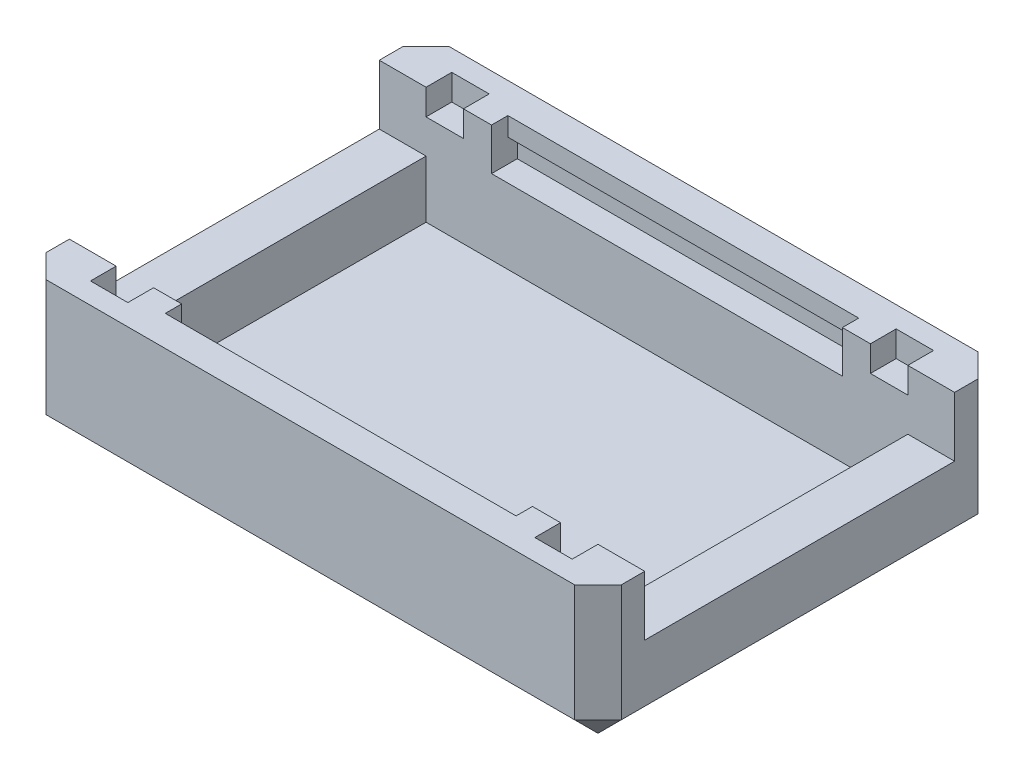
from build123d import *

# Parameters (mm, degrees)
SKETCH1_W           = 24.6
SKETCH1_H           = 17.25
SKETCH1_W_2         = 20.6
SKETCH1_H_2         = 13.25
BOSS_EXTRUDE1_DEPTH = 6
SKETCH2_W           = 20.6
SKETCH2_H           = 13.25
BOSS_EXTRUDE2_DEPTH = 1
SKETCH3_W           = 2
SKETCH3_H           = 13.25
CUT_EXTRUDE1_DEPTH  = 2.55
SKETCH4_W           = 1.6
SKETCH4_H           = 1.1
CUT_EXTRUDE2_DEPTH  = 1.1
SKETCH5_W           = 15
SKETCH5_H           = 1.4
CUT_EXTRUDE3_DEPTH  = 1.8
SKETCH6_W           = 15
SKETCH6_H           = 1
CUT_EXTRUDE4_DEPTH  = 0.4
CHAMFER1_SIZE       = 1
SKETCH8_W           = 0.37991453
SKETCH8_H           = 2.116666667
CUT_EXTRUDE5_DEPTH  = 0.2


with BuildPart() as part:
    # Sketch1 → Boss-Extrude1 (new body)
    with BuildSketch(Plane(origin=(0, 0, 0), x_dir=(1, 0, 0), z_dir=(0, 1, 0))):
        Rectangle(SKETCH1_W, SKETCH1_H)
        Rectangle(SKETCH1_W_2, SKETCH1_H_2, mode=Mode.SUBTRACT)
    extrude(amount=BOSS_EXTRUDE1_DEPTH)

    # Sketch2 → Boss-Extrude2 (add)
    with BuildSketch(Plane.XZ):
        Rectangle(SKETCH2_W, SKETCH2_H)
    extrude(amount=-BOSS_EXTRUDE2_DEPTH)

    # Sketch3 → Cut-Extrude1 (cut)
    with BuildSketch(Plane(origin=(0, 6, 0), x_dir=(1, 0, 0), z_dir=(0, 1, 0))):
        with Locations((-11.3, 0)):
            Rectangle(SKETCH3_W, SKETCH3_H)
        with Locations((11.3, 0)):
            Rectangle(SKETCH3_W, SKETCH3_H)
    extrude(amount=-CUT_EXTRUDE1_DEPTH, mode=Mode.SUBTRACT)

    # Sketch4 → Cut-Extrude2 (cut)
    with BuildSketch(Plane(origin=(0, 6, 0), x_dir=(1, 0, 0), z_dir=(0, 1, 0))):
        with Locations((-9.5, 7.175)):
            Rectangle(SKETCH4_W, SKETCH4_H)
        with Locations((9.5, 7.175)):
            Rectangle(SKETCH4_W, SKETCH4_H)
        with Locations((9.5, -7.175)):
            Rectangle(SKETCH4_W, SKETCH4_H)
        with Locations((-9.5, -7.175)):
            Rectangle(SKETCH4_W, SKETCH4_H)
    extrude(amount=-CUT_EXTRUDE2_DEPTH, mode=Mode.SUBTRACT)

    # Sketch5 → Cut-Extrude3 (cut)
    with BuildSketch(Plane(origin=(0, 6, 0), x_dir=(1, 0, 0), z_dir=(0, 1, 0))):
        with Locations((0, 6.625)):
            Rectangle(SKETCH5_W, SKETCH5_H)
        with Locations((0, -6.625)):
            Rectangle(SKETCH5_W, SKETCH5_H)
    extrude(amount=-CUT_EXTRUDE3_DEPTH, mode=Mode.SUBTRACT)

    # Sketch6 → Cut-Extrude4 (cut)
    with BuildSketch(Plane.XY.offset(-7.325)):
        with Locations((0, 4.7)):
            Rectangle(SKETCH6_W, SKETCH6_H)
    cut_extrude4 = extrude(amount=-CUT_EXTRUDE4_DEPTH, mode=Mode.SUBTRACT)

    # Mirror1: Cut-Extrude4 across plane
    add(cut_extrude4.mirror(Plane.XY), mode=Mode.SUBTRACT)

    # Chamfer1
    chamfer1_edges = [part.edges().sort_by_distance(p)[0] for p in [
        (-12.3, 0, 0),
        (0, 0, -8.625),
        (12.3, 0, 0),
        (0, 0, 8.625),
        (-12.3, 3, 8.625),
        (-12.3, 3, -8.625),
        (12.3, 3, -8.625),
        (12.3, 3, 8.625),
    ]]
    chamfer(chamfer1_edges, length=CHAMFER1_SIZE)

    # Sketch8 → Cut-Extrude5 (cut)
    # profile 1 of 11: a face of its own
    with BuildSketch(Plane.XZ):
        with BuildLine():
            Line((-2.221821581, 4.725609767), (-2.576931424, 4.400710762))
            add(Edge.make_bspline(
                [(-2.576931424, 4.400710762), (-2.592142807, 4.422167999), (-2.621346541, 4.463362902), (-2.668682747, 4.518523848), (-2.715805207, 4.56558024), (-2.76315048, 4.604335498), (-2.811138218, 4.634554155), (-2.859685119, 4.655949298), (-2.90851596, 4.669550393), (-2.941322747, 4.671244057), (-2.957481971, 4.672078283)],
                knots=[0, 0, 0, 0, 1.299362458, 2.494594718, 3.587462134, 4.587049575, 5.512617175, 6.380583204, 7.202344345, 8, 8, 8, 8], degree=3))
            add(Edge.make_bspline(
                [(-2.957481971, 4.672078283), (-2.972554832, 4.671549679), (-3.001656566, 4.670529084), (-3.043143247, 4.660384438), (-3.079975714, 4.642876269), (-3.112118019, 4.619982865), (-3.137579466, 4.592401621), (-3.157908458, 4.563475988), (-3.169355388, 4.531548631), (-3.170862029, 4.509619634), (-3.171607906, 4.49876348)],
                knots=[0, 0, 0, 0, 1.185010067, 2.2879431, 3.333075148, 4.379039566, 5.372662701, 6.27520591, 7.14612461, 8, 8, 8, 8], degree=3))
            add(Edge.make_bspline(
                [(-3.171607906, 4.49876348), (-3.171140503, 4.487750775), (-3.170199218, 4.465572718), (-3.161107685, 4.433068013), (-3.14740415, 4.401307132), (-3.134309863, 4.381972773), (-3.127616687, 4.372089969)],
                knots=[0, 0, 0, 0, 0.967525499, 1.948461899, 2.951351359, 4, 4, 4, 4], degree=3))
            add(Edge.make_bspline(
                [(-3.127616687, 4.372089969), (-3.121531865, 4.364408168), (-3.10752541, 4.346725679), (-3.080817968, 4.318719371), (-3.047279031, 4.284409192), (-3.005617948, 4.24497497), (-2.957564186, 4.198998494), (-2.900890392, 4.148287118), (-2.837227884, 4.09127037), (-2.791978048, 4.051565971), (-2.768266727, 4.030760508)],
                knots=[0, 0, 0, 0, 0.473873513, 1.090794244, 1.870441696, 2.795289791, 3.865433203, 5.087734844, 6.473946851, 8, 8, 8, 8], degree=3))
            add(Edge.make_bspline(
                [(-2.768266727, 4.030760508), (-2.746010241, 4.011498643), (-2.703772055, 3.974943623), (-2.643675504, 3.923059642), (-2.590860645, 3.87638089), (-2.544558085, 3.835607914), (-2.505469727, 3.800312912), (-2.473431242, 3.770327176), (-2.448051335, 3.746234472), (-2.433624344, 3.731682464), (-2.427467281, 3.725472047)],
                knots=[0, 0, 0, 0, 1.543621617, 2.929473131, 4.163658386, 5.240097082, 6.164993805, 6.925417477, 7.541396219, 8, 8, 8, 8], degree=3))
            add(Edge.make_bspline(
                [(-2.427467281, 3.725472047), (-2.404108667, 3.700193023), (-2.359205206, 3.651597862), (-2.300846538, 3.576290646), (-2.252815466, 3.502775447), (-2.215657717, 3.429668959), (-2.187594692, 3.355916399), (-2.167809887, 3.279708991), (-2.155960635, 3.200250414), (-2.154645092, 3.146029636), (-2.153979701, 3.118605227)],
                knots=[0, 0, 0, 0, 1.206664779, 2.319633467, 3.337109185, 4.282041471, 5.190008762, 6.099243693, 7.03861361, 8, 8, 8, 8], degree=3))
            add(Edge.make_bspline(
                [(-2.153979701, 3.118605227), (-2.154453309, 3.091883503), (-2.155382546, 3.039454487), (-2.166763913, 2.962732433), (-2.182993076, 2.889306096), (-2.208086208, 2.819974461), (-2.238669569, 2.753599469), (-2.277010229, 2.691215031), (-2.322036078, 2.632189792), (-2.373642613, 2.5775789), (-2.430725569, 2.528023301), (-2.491952464, 2.483907736), (-2.557922007, 2.447484717), (-2.628070562, 2.41749296), (-2.702360582, 2.394392907), (-2.780703565, 2.377319815), (-2.863219341, 2.367072815), (-2.919644818, 2.366001613), (-2.948471721, 2.365454352)],
                knots=[0, 0, 0, 0, 1.043214005, 2.046824704, 3.02475056, 3.976699089, 4.921714032, 5.875962561, 6.831408892, 7.817874052, 8.806269674, 9.781291748, 10.760897367, 11.74438705, 12.757449933, 13.795994037, 14.874007457, 16, 16, 16, 16], degree=3))
            add(Edge.make_bspline(
                [(-2.948471721, 2.365454352), (-2.971100595, 2.365855803), (-3.015918742, 2.366650907), (-3.081973915, 2.373142268), (-3.145757652, 2.383618633), (-3.207198105, 2.398634394), (-3.266572076, 2.4176614), (-3.323882002, 2.440902159), (-3.378732255, 2.468716894), (-3.431537856, 2.500533623), (-3.482042106, 2.537477036), (-3.530883611, 2.578791839), (-3.577577231, 2.625113469), (-3.622347225, 2.67633238), (-3.664907144, 2.732593609), (-3.706650125, 2.793113617), (-3.745720985, 2.859015571), (-3.769856794, 2.905246325), (-3.782184829, 2.928859967)],
                knots=[0, 0, 0, 0, 1.016823716, 2.013894106, 2.979844003, 3.91962641, 4.853723003, 5.779685073, 6.695824784, 7.614987388, 8.547259901, 9.504950863, 10.487499108, 11.500346958, 12.559593716, 13.656357062, 14.802919212, 16, 16, 16, 16], degree=3))
            Line((-3.782184829, 2.928859967), (-3.364533253, 3.179556916))
            add(Edge.make_bspline(
                [(-3.364533253, 3.179556916), (-3.349112724, 3.152752346), (-3.319550251, 3.101365695), (-3.269453877, 3.032321215), (-3.218132699, 2.973196048), (-3.164400218, 2.925035233), (-3.1089098, 2.8871948), (-3.051393415, 2.860151401), (-2.991810651, 2.843411567), (-2.95122558, 2.841367247), (-2.930981237, 2.840347514)],
                knots=[0, 0, 0, 0, 1.283663364, 2.460892379, 3.537111102, 4.529833553, 5.449777664, 6.316464042, 7.160231139, 8, 8, 8, 8], degree=3))
            add(Edge.make_bspline(
                [(-2.930981237, 2.840347514), (-2.910389841, 2.841180283), (-2.870439536, 2.842795976), (-2.813415587, 2.857719646), (-2.761133871, 2.881150902), (-2.715941942, 2.914584073), (-2.677676266, 2.953171034), (-2.649434001, 2.996100793), (-2.631692019, 3.042549755), (-2.629816262, 3.07481626), (-2.628872863, 3.091044463)],
                knots=[0, 0, 0, 0, 1.13588714, 2.203786484, 3.234766741, 4.283437687, 5.291419208, 6.222934724, 7.106237994, 8, 8, 8, 8], degree=3))
            add(Edge.make_bspline(
                [(-2.628872863, 3.091044463), (-2.629744053, 3.106142165), (-2.631513792, 3.136811701), (-2.644549145, 3.18241237), (-2.664927377, 3.2279923), (-2.689036262, 3.265378192), (-2.713570071, 3.296680386), (-2.737029927, 3.323802322), (-2.765597825, 3.353767312), (-2.799201331, 3.386613051), (-2.837396453, 3.422628688), (-2.880215367, 3.461810696), (-2.928148394, 3.503813929), (-2.962027552, 3.532426116), (-2.979742588, 3.547387111)],
                knots=[0, 0, 0, 0, 0.916159276, 1.861089862, 2.860218735, 3.940849679, 4.552606315, 5.27541173, 6.11797699, 7.06649574, 8.129236253, 9.306560635, 10.591630461, 12, 12, 12, 12], degree=3))
            add(Edge.make_bspline(
                [(-2.979742588, 3.547387111), (-3.013419576, 3.575881072), (-3.078055909, 3.630569608), (-3.169395248, 3.711342854), (-3.251700171, 3.786832853), (-3.324259805, 3.857972828), (-3.38799867, 3.923448987), (-3.4424851, 3.983793153), (-3.487120537, 4.039470799), (-3.534089709, 4.105417244), (-3.578719814, 4.185777519), (-3.617292889, 4.282460246), (-3.642317473, 4.379130705), (-3.645121129, 4.444029926), (-3.646501068, 4.475972848)],
                knots=[0, 0, 0, 0, 1.345494975, 2.582412109, 3.71882943, 4.751509156, 5.681369928, 6.505683931, 7.230279997, 7.856715994, 8.973648664, 10.023341002, 11.027102913, 12, 12, 12, 12], degree=3))
            add(Edge.make_bspline(
                [(-3.646501068, 4.475972848), (-3.645927153, 4.498625054), (-3.64479648, 4.543252332), (-3.634710693, 4.608870242), (-3.619637102, 4.672186013), (-3.597745919, 4.732968638), (-3.569333808, 4.791141985), (-3.534828402, 4.846990837), (-3.493693898, 4.900001175), (-3.447338089, 4.950137855), (-3.396265856, 4.995957076), (-3.341688684, 5.036397129), (-3.283915486, 5.070553386), (-3.223299689, 5.098888481), (-3.159465681, 5.120577196), (-3.092883724, 5.135951239), (-3.02345832, 5.145095229), (-2.976236659, 5.146338249), (-2.952181824, 5.146971446)],
                knots=[0, 0, 0, 0, 1.010766082, 1.991317756, 2.957454644, 3.913069143, 4.869106762, 5.843196583, 6.838735724, 7.860187025, 8.887984031, 9.89767229, 10.887916223, 11.879572884, 12.879850636, 13.892031539, 14.926195476, 16, 16, 16, 16], degree=3))
            add(Edge.make_bspline(
                [(-2.952181824, 5.146971446), (-2.921007949, 5.145831039), (-2.858906273, 5.143559227), (-2.767087155, 5.125794403), (-2.677402079, 5.097857346), (-2.605132164, 5.064154359), (-2.547628342, 5.031506261), (-2.503557034, 5.001448004), (-2.458712106, 4.967014655), (-2.412731911, 4.928097706), (-2.366470832, 4.88396391), (-2.318613447, 4.835663907), (-2.26981187, 4.782780272), (-2.238098583, 4.745000448), (-2.221821581, 4.725609767)],
                knots=[0, 0, 0, 0, 1.282922637, 2.555718331, 3.837320111, 5.142675274, 5.830281639, 6.55870424, 7.337177975, 8.157850921, 9.037902056, 9.96903443, 10.957596896, 12, 12, 12, 12], degree=3))
        make_face()
    # profile 2 of 11: a face of its own
    with BuildSketch(Plane.XZ):
        Polygon((-1.93349359, 5.079129566), (-1.443230001, 5.079129566), (-1.051549145, 3.389972748), (-0.602626703, 5.079129566), (-0.140983908, 5.079129566), (0.305288462, 3.389972748), (0.695909288, 5.079129566), (1.187232906, 5.079129566), (0.575065939, 2.433296232), (0.078972189, 2.433296232), (-0.373130342, 4.143653637), (-0.827882946, 2.433296232), (-1.320266593, 2.433296232), align=None)
    # profile 3 of 11: a face of its own
    with BuildSketch(Plane.XZ):
        with BuildLine():
            Line((1.611244658, 5.079129566), (2.209631243, 5.079129566))
            add(Edge.make_bspline(
                [(2.209631243, 5.079129566), (2.25628236, 5.078803458), (2.346459497, 5.078173089), (2.477108328, 5.071070346), (2.598595115, 5.060146831), (2.710998171, 5.045119557), (2.814087053, 5.025234358), (2.907728828, 5.000292273), (2.992237781, 4.971500786), (3.068540536, 4.937621759), (3.138197612, 4.898122178), (3.204339228, 4.854122815), (3.266835518, 4.804011847), (3.326563518, 4.748756012), (3.382752425, 4.687344424), (3.436337986, 4.620794279), (3.486008183, 4.54814051), (3.533264439, 4.471125123), (3.576001435, 4.389421737), (3.613278239, 4.303725792), (3.644505245, 4.214588774), (3.669878803, 4.121915687), (3.690104458, 4.026014176), (3.704255941, 3.926690722), (3.713004529, 3.82403728), (3.713892, 3.754464003), (3.714342949, 3.719111871)],
                knots=[0, 0, 0, 0, 1.44355588, 2.790409838, 4.047694926, 5.217575253, 6.298404546, 7.294384826, 8.214239204, 9.058592145, 9.873746385, 10.689560431, 11.514393297, 12.350027578, 13.205127629, 14.088021785, 14.991911688, 15.926770944, 16.882954281, 17.842803888, 18.816321264, 19.80318086, 20.814351908, 21.847355356, 22.906180909, 24, 24, 24, 24], degree=3))
            add(Edge.make_bspline(
                [(3.714342949, 3.719111871), (3.713162121, 3.66922771), (3.710837592, 3.571027821), (3.691257062, 3.426920614), (3.659588715, 3.288779484), (3.615060143, 3.157685023), (3.559856633, 3.034804647), (3.493909859, 2.9223053), (3.418186755, 2.820790821), (3.333569497, 2.73076667), (3.241949616, 2.653389692), (3.146738085, 2.587121973), (3.047007368, 2.534864347), (2.95913067, 2.501725197), (2.882930609, 2.481115513), (2.81602778, 2.468934991), (2.740032992, 2.457764718), (2.654237661, 2.449132571), (2.559018151, 2.441434818), (2.453994917, 2.437252158), (2.339507993, 2.433776989), (2.259986, 2.433460683), (2.218641493, 2.433296232)],
                knots=[0, 0, 0, 0, 1.315458931, 2.589557908, 3.828601765, 5.048913369, 6.235739168, 7.376350998, 8.481830359, 9.569842114, 10.627874879, 11.640079404, 12.624025415, 13.590060155, 14.111227486, 14.704434459, 15.382649715, 16.137166398, 16.978595427, 17.902333227, 18.909396075, 20, 20, 20, 20], degree=3))
            Line((2.218641493, 2.433296232), (1.611244658, 2.433296232))
            Line((1.611244658, 2.433296232), (1.611244658, 5.079129566))
        make_face()
        with BuildLine():
            Line((2.086137821, 4.604236403), (2.086137821, 2.908189395))
            Line((2.086137821, 2.908189395), (2.334184696, 2.908189395))
            add(Edge.make_bspline(
                [(2.334184696, 2.908189395), (2.363698464, 2.908243476), (2.420463267, 2.908347493), (2.502418792, 2.913301894), (2.578206873, 2.918274747), (2.647618881, 2.927713388), (2.711159977, 2.938227369), (2.767957273, 2.952859014), (2.819181606, 2.968228318), (2.864207282, 2.987795346), (2.905447133, 3.009819339), (2.943630524, 3.035623), (2.980488187, 3.064276992), (3.015331038, 3.096624071), (3.048290948, 3.132235899), (3.079172908, 3.171295969), (3.108389107, 3.213685108), (3.135189623, 3.259627437), (3.159680078, 3.308637795), (3.181405856, 3.360241445), (3.199419732, 3.414868135), (3.214391762, 3.472006493), (3.225090976, 3.532153973), (3.233942534, 3.594865071), (3.238505771, 3.660388243), (3.239132046, 3.7049724), (3.239449786, 3.727592106)],
                knots=[0, 0, 0, 0, 1.50275155, 2.890291501, 4.180787663, 5.369391935, 6.45668281, 7.458360028, 8.354766181, 9.177074746, 9.954075863, 10.732690366, 11.5210699, 12.329727389, 13.151100085, 13.990027547, 14.863562427, 15.770965086, 16.696477834, 17.652329173, 18.619756807, 19.62365428, 20.657822005, 21.729286259, 22.847956731, 24, 24, 24, 24], degree=3))
            add(Edge.make_bspline(
                [(3.239449786, 3.727592106), (3.238816956, 3.762254667), (3.237582986, 3.829843975), (3.225682845, 3.928289278), (3.206311685, 4.020990279), (3.178670906, 4.107602939), (3.143828848, 4.188370685), (3.10021589, 4.262609243), (3.049708966, 4.33156572), (3.009769469, 4.372017802), (2.989812867, 4.392230527)],
                knots=[0, 0, 0, 0, 1.13821349, 2.219428113, 3.251817212, 4.244760574, 5.201143372, 6.134805572, 7.068016741, 8, 8, 8, 8], degree=3))
            add(Edge.make_bspline(
                [(2.989812867, 4.392230527), (2.970133768, 4.409454502), (2.929941436, 4.44463252), (2.85937691, 4.486784781), (2.781618456, 4.523819675), (2.694887195, 4.553184215), (2.600021345, 4.576406945), (2.496455885, 4.592423094), (2.384745429, 4.602714902), (2.307355027, 4.60371837), (2.267402845, 4.604236403)],
                knots=[0, 0, 0, 0, 0.813307809, 1.661089106, 2.549956539, 3.493439533, 4.508053171, 5.589449661, 6.755572447, 8, 8, 8, 8], degree=3))
            Line((2.267402845, 4.604236403), (2.086137821, 4.604236403))
        make_face(mode=Mode.SUBTRACT)
    # profile 4 of 11: a face of its own
    with BuildSketch(Plane.XZ):
        with Locations((-6.458547009, -2.592805022)):
            Rectangle(SKETCH8_W, SKETCH8_H)
    # profile 5 of 11: a face of its own
    with BuildSketch(Plane.XZ):
        with BuildLine():
            Line((-4.69465812, -1.817287527), (-4.978745994, -2.077206731))
            add(Edge.make_bspline(
                [(-4.978745994, -2.077206731), (-4.9909151, -2.060040941), (-5.014278087, -2.027085019), (-5.052147053, -1.982956262), (-5.08984502, -1.945311149), (-5.127721239, -1.914306942), (-5.166111429, -1.890132017), (-5.20494895, -1.873015902), (-5.244013623, -1.862135026), (-5.270259052, -1.860780095), (-5.283186432, -1.860112714)],
                knots=[0, 0, 0, 0, 1.299362458, 2.494594718, 3.587462134, 4.587049575, 5.512617175, 6.380583204, 7.202344345, 8, 8, 8, 8], degree=3))
            add(Edge.make_bspline(
                [(-5.283186432, -1.860112714), (-5.29524472, -1.860535597), (-5.318526108, -1.861352074), (-5.351715453, -1.86946779), (-5.381181426, -1.883474325), (-5.40689527, -1.901789048), (-5.427264428, -1.923854043), (-5.443527621, -1.94699455), (-5.452685165, -1.972536436), (-5.453890478, -1.990079633), (-5.454487179, -1.998764557)],
                knots=[0, 0, 0, 0, 1.185010067, 2.2879431, 3.333075148, 4.379039566, 5.372662701, 6.27520591, 7.14612461, 8, 8, 8, 8], degree=3))
            add(Edge.make_bspline(
                [(-5.454487179, -1.998764557), (-5.454113257, -2.007574721), (-5.453360229, -2.025317166), (-5.446087003, -2.05132093), (-5.435124175, -2.076729635), (-5.424648745, -2.092197122), (-5.419294204, -2.100103365)],
                knots=[0, 0, 0, 0, 0.967525499, 1.948461899, 2.951351359, 4, 4, 4, 4], degree=3))
            add(Edge.make_bspline(
                [(-5.419294204, -2.100103365), (-5.414426347, -2.106248806), (-5.403221183, -2.120394798), (-5.381855229, -2.142799844), (-5.355024079, -2.170247987), (-5.321695213, -2.201795365), (-5.283252204, -2.238576545), (-5.237913168, -2.279145646), (-5.186983162, -2.324759045), (-5.150783293, -2.356522564), (-5.131814236, -2.373166934)],
                knots=[0, 0, 0, 0, 0.473873513, 1.090794244, 1.870441696, 2.795289791, 3.865433203, 5.087734844, 6.473946851, 8, 8, 8, 8], degree=3))
            add(Edge.make_bspline(
                [(-5.131814236, -2.373166934), (-5.114009047, -2.388576426), (-5.080218499, -2.417820442), (-5.032141258, -2.459327627), (-4.98988937, -2.496670629), (-4.952847323, -2.52928901), (-4.921576636, -2.557525011), (-4.895945848, -2.5815136), (-4.875641923, -2.600787763), (-4.86410033, -2.612429369), (-4.859174679, -2.617397703)],
                knots=[0, 0, 0, 0, 1.543621617, 2.929473131, 4.163658386, 5.240097082, 6.164993805, 6.925417477, 7.541396219, 8, 8, 8, 8], degree=3))
            add(Edge.make_bspline(
                [(-4.859174679, -2.617397703), (-4.840487788, -2.637620922), (-4.80456502, -2.67649705), (-4.757878085, -2.736742824), (-4.719453227, -2.795554982), (-4.689727029, -2.854040173), (-4.667276608, -2.913042221), (-4.651448764, -2.974008148), (-4.641969363, -3.037575009), (-4.640916928, -3.080951632), (-4.640384615, -3.102891159)],
                knots=[0, 0, 0, 0, 1.206664779, 2.319633467, 3.337109185, 4.282041471, 5.190008762, 6.099243693, 7.03861361, 8, 8, 8, 8], degree=3))
            add(Edge.make_bspline(
                [(-4.640384615, -3.102891159), (-4.640763502, -3.124268538), (-4.641506891, -3.16621175), (-4.650611985, -3.227589394), (-4.663595315, -3.286330463), (-4.683669821, -3.341795772), (-4.70813651, -3.394895766), (-4.738809038, -3.444803316), (-4.774829717, -3.492023507), (-4.816114945, -3.53571222), (-4.86178131, -3.5753567), (-4.910762826, -3.610649152), (-4.96353846, -3.639787567), (-5.019657304, -3.663780973), (-5.079089321, -3.682261015), (-5.141763707, -3.695919488), (-5.207776328, -3.704117089), (-5.252916709, -3.70497405), (-5.275978232, -3.705411859)],
                knots=[0, 0, 0, 0, 1.043214005, 2.046824704, 3.02475056, 3.976699089, 4.921714032, 5.875962561, 6.831408892, 7.817874052, 8.806269674, 9.781291748, 10.760897367, 11.74438705, 12.757449933, 13.795994037, 14.874007457, 16, 16, 16, 16], degree=3))
            add(Edge.make_bspline(
                [(-5.275978232, -3.705411859), (-5.294081331, -3.705090698), (-5.329935848, -3.704454615), (-5.382779987, -3.699261526), (-5.433806976, -3.690880434), (-5.482959339, -3.678867825), (-5.530458516, -3.663646221), (-5.576306457, -3.645053613), (-5.620186658, -3.622801826), (-5.662431139, -3.597348442), (-5.702834539, -3.567793711), (-5.741907743, -3.53474187), (-5.779262639, -3.497684565), (-5.815078635, -3.456709437), (-5.84912657, -3.411700453), (-5.882520955, -3.363284447), (-5.913777643, -3.310562884), (-5.93308629, -3.273578281), (-5.942948718, -3.254687366)],
                knots=[0, 0, 0, 0, 1.016823716, 2.013894106, 2.979844003, 3.91962641, 4.853723003, 5.779685073, 6.695824784, 7.614987388, 8.547259901, 9.504950863, 10.487499108, 11.500346958, 12.559593716, 13.656357062, 14.802919212, 16, 16, 16, 16], degree=3))
            Line((-5.942948718, -3.254687366), (-5.608827457, -3.054129808))
            add(Edge.make_bspline(
                [(-5.608827457, -3.054129808), (-5.596491034, -3.075573464), (-5.572841055, -3.116682785), (-5.532763956, -3.171918368), (-5.491707014, -3.219218502), (-5.448721029, -3.257747154), (-5.404328695, -3.288019501), (-5.358315587, -3.30965422), (-5.310649376, -3.323046087), (-5.278181318, -3.324681543), (-5.261985844, -3.325497329)],
                knots=[0, 0, 0, 0, 1.283663364, 2.460892379, 3.537111102, 4.529833553, 5.449777664, 6.316464042, 7.160231139, 8, 8, 8, 8], degree=3))
            add(Edge.make_bspline(
                [(-5.261985844, -3.325497329), (-5.245512728, -3.324831114), (-5.213552483, -3.323538559), (-5.167933324, -3.311599624), (-5.126107952, -3.292854619), (-5.089954409, -3.266108082), (-5.059341868, -3.235238513), (-5.036748056, -3.200894706), (-5.02255447, -3.163735536), (-5.021053864, -3.137922333), (-5.020299145, -3.12493977)],
                knots=[0, 0, 0, 0, 1.13588714, 2.203786484, 3.234766741, 4.283437687, 5.291419208, 6.222934724, 7.106237994, 8, 8, 8, 8], degree=3))
            add(Edge.make_bspline(
                [(-5.020299145, -3.12493977), (-5.020996097, -3.112861609), (-5.022411889, -3.08832598), (-5.03284017, -3.051845445), (-5.049142756, -3.0153815), (-5.068429864, -2.985472787), (-5.088056912, -2.960431031), (-5.106824796, -2.938733483), (-5.129679115, -2.914761491), (-5.156561919, -2.8884849), (-5.187118017, -2.85967239), (-5.221373148, -2.828326784), (-5.25971957, -2.794724198), (-5.286822897, -2.771834448), (-5.300994925, -2.759865652)],
                knots=[0, 0, 0, 0, 0.916159276, 1.861089862, 2.860218735, 3.940849679, 4.552606315, 5.27541173, 6.11797699, 7.06649574, 8.129236253, 9.306560635, 10.591630461, 12, 12, 12, 12], degree=3))
            add(Edge.make_bspline(
                [(-5.300994925, -2.759865652), (-5.327936516, -2.737070483), (-5.379645582, -2.693319654), (-5.452717053, -2.628701057), (-5.518560992, -2.568309058), (-5.576608698, -2.511397078), (-5.627599791, -2.459016151), (-5.671188935, -2.410740818), (-5.706897284, -2.366198702), (-5.744472622, -2.313441545), (-5.780176706, -2.249153325), (-5.811035166, -2.171807144), (-5.831054833, -2.094470777), (-5.833297758, -2.042551399), (-5.834401709, -2.016997062)],
                knots=[0, 0, 0, 0, 1.345494975, 2.582412109, 3.71882943, 4.751509156, 5.681369928, 6.505683931, 7.230279997, 7.856715994, 8.973648664, 10.023341002, 11.027102913, 12, 12, 12, 12], degree=3))
            add(Edge.make_bspline(
                [(-5.834401709, -2.016997062), (-5.833942577, -1.998875297), (-5.833038038, -1.963173475), (-5.824969409, -1.910679147), (-5.812910536, -1.86002653), (-5.79539759, -1.81140043), (-5.772667901, -1.764861753), (-5.745063576, -1.720182671), (-5.712155973, -1.677774401), (-5.675071326, -1.637665056), (-5.634213539, -1.60100968), (-5.590551802, -1.568657637), (-5.544333244, -1.541332632), (-5.495840606, -1.518664556), (-5.444773399, -1.501313583), (-5.391507834, -1.489014349), (-5.335967511, -1.481699157), (-5.298190182, -1.480704742), (-5.278946314, -1.480198184)],
                knots=[0, 0, 0, 0, 1.010766082, 1.991317756, 2.957454644, 3.913069143, 4.869106762, 5.843196583, 6.838735724, 7.860187025, 8.887984031, 9.89767229, 10.887916223, 11.879572884, 12.879850636, 13.892031539, 14.926195476, 16, 16, 16, 16], degree=3))
            add(Edge.make_bspline(
                [(-5.278946314, -1.480198184), (-5.254007214, -1.481110509), (-5.204325873, -1.482927958), (-5.130870579, -1.497139818), (-5.059122518, -1.519489464), (-5.001306586, -1.546451853), (-4.955303528, -1.572570332), (-4.920046482, -1.596616937), (-4.884170539, -1.624163616), (-4.847386383, -1.655297176), (-4.810377521, -1.690604212), (-4.772091612, -1.729244215), (-4.733050351, -1.771551123), (-4.707679721, -1.801774982), (-4.69465812, -1.817287527)],
                knots=[0, 0, 0, 0, 1.282922637, 2.555718331, 3.837320111, 5.142675274, 5.830281639, 6.55870424, 7.337177975, 8.157850921, 9.037902056, 9.96903443, 10.957596896, 12, 12, 12, 12], degree=3))
        make_face()
    # profile 6 of 11: a face of its own
    with BuildSketch(Plane.XZ):
        with BuildLine():
            add(Edge.make_bspline(
                [(-3.265738515, -1.480198184), (-3.228937671, -1.481151024), (-3.156284469, -1.483032145), (-3.049437828, -1.498712761), (-2.946471333, -1.524262076), (-2.847431545, -1.559777473), (-2.75256645, -1.606220887), (-2.661541426, -1.662275619), (-2.574682519, -1.728999668), (-2.492879792, -1.804836471), (-2.417279319, -1.887305683), (-2.351771464, -1.976098451), (-2.295908769, -2.068914067), (-2.249609618, -2.166001231), (-2.214344197, -2.268032319), (-2.189596992, -2.374487107), (-2.173698139, -2.48533531), (-2.171869526, -2.560807827), (-2.170940171, -2.599165198)],
                knots=[0, 0, 0, 0, 1.014329547, 2.002516266, 2.970391464, 3.935626869, 4.897733899, 5.877609409, 6.878433252, 7.912639331, 8.949961323, 9.958554974, 10.949718813, 11.932905612, 12.9188844, 13.919928257, 14.942845884, 16, 16, 16, 16], degree=3))
            add(Edge.make_bspline(
                [(-2.170940171, -2.599165198), (-2.171929894, -2.637090369), (-2.173880175, -2.711823136), (-2.188947931, -2.821649829), (-2.214111882, -2.926964265), (-2.248779174, -3.028004825), (-2.294238634, -3.124282103), (-2.349011945, -3.216410816), (-2.414544473, -3.303535988), (-2.488445987, -3.385610865), (-2.569805141, -3.460111427), (-2.655977401, -3.525764918), (-2.746564876, -3.581397209), (-2.841434975, -3.626982817), (-2.940791143, -3.662360129), (-3.044387958, -3.687321393), (-3.152219008, -3.702490858), (-3.225549352, -3.7044284), (-3.262770433, -3.705411859)],
                knots=[0, 0, 0, 0, 1.051557043, 2.072126891, 3.067553643, 4.050577992, 5.02905126, 6.015227836, 7.017913613, 8.04756643, 9.074058332, 10.072836633, 11.047628519, 12.017157415, 12.98668631, 13.966869689, 14.968021931, 16, 16, 16, 16], degree=3))
            add(Edge.make_bspline(
                [(-3.262770433, -3.705411859), (-3.30169922, -3.704529648), (-3.378188965, -3.702796223), (-3.49013205, -3.686312143), (-3.597383198, -3.661481361), (-3.699041438, -3.624422751), (-3.796142072, -3.578096372), (-3.887971672, -3.521042659), (-3.97449938, -3.453355898), (-4.055228856, -3.376769571), (-4.128369958, -3.292967332), (-4.192931326, -3.204437697), (-4.247390273, -3.111856956), (-4.29174879, -3.015181779), (-4.326719263, -2.915012978), (-4.351386958, -2.810740497), (-4.365958754, -2.702614419), (-4.367988521, -2.629173025), (-4.369017094, -2.591956998)],
                knots=[0, 0, 0, 0, 1.067978421, 2.098431617, 3.099715153, 4.085208694, 5.062210972, 6.048429807, 7.046490867, 8.072918869, 9.098532598, 10.095778865, 11.076610158, 12.041847152, 13.011192615, 13.984257998, 14.978533688, 16, 16, 16, 16], degree=3))
            add(Edge.make_bspline(
                [(-4.369017094, -2.591956998), (-4.368694268, -2.566920003), (-4.368052705, -2.517163039), (-4.360324399, -2.443425758), (-4.34919786, -2.371127729), (-4.332742237, -2.300557207), (-4.31275286, -2.231216348), (-4.286853799, -2.163750595), (-4.257373659, -2.097439228), (-4.222928891, -2.033065468), (-4.184629639, -1.971221605), (-4.142841746, -1.91219937), (-4.097460136, -1.856712427), (-4.048630998, -1.804396138), (-3.99618606, -1.755594383), (-3.940815182, -1.709616304), (-3.881444491, -1.667683243), (-3.819373425, -1.628771111), (-3.754951926, -1.593583545), (-3.688442249, -1.563632941), (-3.621214624, -1.537477589), (-3.55237098, -1.516834628), (-3.4826491, -1.500021153), (-3.411304147, -1.488902113), (-3.338980682, -1.481174021), (-3.29021051, -1.480524235), (-3.265738515, -1.480198184)],
                knots=[0, 0, 0, 0, 1.034744296, 2.056386356, 3.06226378, 4.057406941, 5.050368692, 6.043467995, 7.042652155, 8.049140477, 9.059438543, 10.048523776, 11.036952808, 12.020949711, 13.004946614, 13.997082645, 14.994316842, 16.007702937, 17.024872941, 18.026463647, 19.021641123, 20.005082605, 20.995858141, 21.984425357, 22.988620895, 24, 24, 24, 24], degree=3))
        make_face()
        with BuildLine():
            add(Edge.make_bspline(
                [(-3.271674679, -1.860112714), (-3.296441643, -1.860777267), (-3.345321717, -1.862088829), (-3.417019885, -1.872081159), (-3.485852658, -1.888040045), (-3.551438468, -1.911156297), (-3.614061572, -1.940577418), (-3.67383298, -1.976200608), (-3.729924981, -2.019250375), (-3.783085508, -2.067415567), (-3.831107297, -2.121082661), (-3.873536062, -2.178596079), (-3.909042105, -2.239859774), (-3.938778638, -2.304304622), (-3.961163657, -2.372655288), (-3.977107835, -2.444376374), (-3.98718396, -2.519591458), (-3.988454068, -2.570865483), (-3.989102564, -2.597045139)],
                knots=[0, 0, 0, 0, 1.033739768, 2.040188636, 3.016340934, 3.979330865, 4.937572243, 5.900995986, 6.878200029, 7.884839167, 8.891893314, 9.879764717, 10.863503415, 11.843163062, 12.837761627, 13.859916423, 14.907309254, 16, 16, 16, 16], degree=3))
            add(Edge.make_bspline(
                [(-3.989102564, -2.597045139), (-3.988242758, -2.626058087), (-3.986557679, -2.682918658), (-3.974701263, -2.765865328), (-3.954416116, -2.844200225), (-3.925124757, -2.917540225), (-3.888795787, -2.986699714), (-3.843680973, -3.050831044), (-3.79051096, -3.110318203), (-3.749549213, -3.145049285), (-3.728759348, -3.162676816)],
                knots=[0, 0, 0, 0, 1.078454662, 2.113592447, 3.107694534, 4.079536787, 5.043276885, 6.005368276, 6.987637804, 8, 8, 8, 8], degree=3))
            add(Edge.make_bspline(
                [(-3.728759348, -3.162676816), (-3.71172848, -3.17569936), (-3.678050451, -3.201451046), (-3.624292986, -3.234457116), (-3.568933381, -3.262746609), (-3.51155388, -3.285604186), (-3.452275666, -3.303583571), (-3.391106867, -3.316174239), (-3.328134154, -3.324075972), (-3.285549054, -3.325020379), (-3.264042468, -3.325497329)],
                knots=[0, 0, 0, 0, 1.023928204, 2.024787132, 3.009472467, 3.9914905, 4.972207045, 5.96565515, 6.972602802, 8, 8, 8, 8], degree=3))
            add(Edge.make_bspline(
                [(-3.264042468, -3.325497329), (-3.239701373, -3.324827141), (-3.191809504, -3.323508525), (-3.121446037, -3.313639207), (-3.054035698, -3.296936756), (-2.989159998, -3.274023289), (-2.927006011, -3.24423276), (-2.867877499, -3.20750465), (-2.811670794, -3.164289933), (-2.758577992, -3.115492226), (-2.710048662, -3.061613721), (-2.667708436, -3.003793533), (-2.631073479, -2.943305613), (-2.601955318, -2.879293846), (-2.578685917, -2.812362473), (-2.562933636, -2.742215071), (-2.55277239, -2.669140813), (-2.551501924, -2.619411198), (-2.550854701, -2.594077057)],
                knots=[0, 0, 0, 0, 1.026359118, 2.019393844, 2.989460624, 3.950973911, 4.916101784, 5.890408035, 6.881132271, 7.902007068, 8.92769091, 9.933912415, 10.920395702, 11.90457117, 12.894218921, 13.903490204, 14.931958862, 16, 16, 16, 16], degree=3))
            add(Edge.make_bspline(
                [(-2.550854701, -2.594077057), (-2.551524318, -2.568888594), (-2.552842358, -2.519308947), (-2.562729047, -2.446422562), (-2.579325575, -2.37658484), (-2.602307849, -2.309681728), (-2.631654997, -2.245647636), (-2.667945722, -2.184707747), (-2.711052685, -2.126920974), (-2.759983781, -2.072681111), (-2.813242273, -2.022838152), (-2.870420585, -1.979583524), (-2.929918805, -1.941996628), (-2.993102111, -1.912552571), (-3.058677826, -1.889094553), (-3.127046098, -1.871819733), (-3.198465873, -1.862159026), (-3.247054224, -1.860800898), (-3.271674679, -1.860112714)],
                knots=[0, 0, 0, 0, 1.055025985, 2.07665775, 3.074803781, 4.057872707, 5.035505728, 6.020516407, 7.023567878, 8.050795229, 9.077271434, 10.074415901, 11.050397877, 12.019801805, 12.988065821, 13.964604439, 14.968634123, 16, 16, 16, 16], degree=3))
        make_face(mode=Mode.SUBTRACT)
    # profile 7 of 11: a face of its own
    with BuildSketch(Plane.XZ):
        Polygon((-1.791025641, -1.534471688), (-1.411111111, -1.534471688), (-1.411111111, -3.271223825), (-0.814102564, -3.271223825), (-0.814102564, -3.651138355), (-1.791025641, -3.651138355), align=None)
    # profile 8 of 11: a face of its own
    with BuildSketch(Plane.XZ):
        Polygon((0.163244525, -1.534471688), (0.515598291, -1.534471688), (1.370405983, -3.651138355), (0.964626736, -3.651138355), (0.800110176, -3.216950321), (-0.122115385, -3.216950321), (-0.286631944, -3.651138355), (-0.691987179, -3.651138355), align=None)
        Polygon((0.339209402, -2.102223424), (0.022048611, -2.837035791), (0.656370192, -2.837035791), align=None, mode=Mode.SUBTRACT)
    # profile 9 of 11: a face of its own
    with BuildSketch(Plane.XZ):
        Polygon((1.465384615, -1.534471688), (2.605128205, -1.534471688), (2.605128205, -1.914386218), (2.225213675, -1.914386218), (2.225213675, -3.651138355), (1.845299145, -3.651138355), (1.845299145, -1.914386218), (1.465384615, -1.914386218), align=None)
    # profile 10 of 11: a face of its own
    with BuildSketch(Plane.XZ):
        with BuildLine():
            add(Edge.make_bspline(
                [(3.898364049, -1.480198184), (3.935164893, -1.481151024), (4.007818095, -1.483032145), (4.114664736, -1.498712761), (4.217631231, -1.524262076), (4.316671019, -1.559777473), (4.411536114, -1.606220887), (4.502561139, -1.662275619), (4.589420045, -1.728999668), (4.671222772, -1.804836471), (4.746823246, -1.887305683), (4.8123311, -1.976098451), (4.868193795, -2.068914067), (4.914492946, -2.166001231), (4.949758367, -2.268032319), (4.974505572, -2.374487107), (4.990404425, -2.48533531), (4.992233038, -2.560807827), (4.993162393, -2.599165198)],
                knots=[0, 0, 0, 0, 1.014329547, 2.002516266, 2.970391464, 3.935626869, 4.897733899, 5.877609409, 6.878433252, 7.912639331, 8.949961323, 9.958554974, 10.949718813, 11.932905612, 12.9188844, 13.919928257, 14.942845884, 16, 16, 16, 16], degree=3))
            add(Edge.make_bspline(
                [(4.993162393, -2.599165198), (4.99217267, -2.637090369), (4.990222389, -2.711823136), (4.975154633, -2.821649829), (4.949990682, -2.926964265), (4.91532339, -3.028004825), (4.869863931, -3.124282103), (4.815090619, -3.216410816), (4.749558092, -3.303535988), (4.675656577, -3.385610865), (4.594297423, -3.460111427), (4.508125164, -3.525764918), (4.417537689, -3.581397209), (4.322667589, -3.626982817), (4.223311421, -3.662360129), (4.119714607, -3.687321393), (4.011883556, -3.702490858), (3.938553212, -3.7044284), (3.901332131, -3.705411859)],
                knots=[0, 0, 0, 0, 1.051557043, 2.072126891, 3.067553643, 4.050577992, 5.02905126, 6.015227836, 7.017913613, 8.04756643, 9.074058332, 10.072836633, 11.047628519, 12.017157415, 12.98668631, 13.966869689, 14.968021931, 16, 16, 16, 16], degree=3))
            add(Edge.make_bspline(
                [(3.901332131, -3.705411859), (3.862403344, -3.704529648), (3.785913599, -3.702796223), (3.673970514, -3.686312143), (3.566719366, -3.661481361), (3.465061126, -3.624422751), (3.367960493, -3.578096372), (3.276130892, -3.521042659), (3.189603184, -3.453355898), (3.108873708, -3.376769571), (3.035732607, -3.292967332), (2.971171238, -3.204437697), (2.916712292, -3.111856956), (2.872353774, -3.015181779), (2.837383301, -2.915012978), (2.812715606, -2.810740497), (2.79814381, -2.702614419), (2.796114043, -2.629173025), (2.79508547, -2.591956998)],
                knots=[0, 0, 0, 0, 1.067978421, 2.098431617, 3.099715153, 4.085208694, 5.062210972, 6.048429807, 7.046490867, 8.072918869, 9.098532598, 10.095778865, 11.076610158, 12.041847152, 13.011192615, 13.984257998, 14.978533688, 16, 16, 16, 16], degree=3))
            add(Edge.make_bspline(
                [(2.79508547, -2.591956998), (2.795408296, -2.566920003), (2.796049859, -2.517163039), (2.803778165, -2.443425758), (2.814904704, -2.371127729), (2.831360328, -2.300557207), (2.851349704, -2.231216348), (2.877248765, -2.163750595), (2.906728905, -2.097439228), (2.941173673, -2.033065468), (2.979472925, -1.971221605), (3.021260818, -1.91219937), (3.066642428, -1.856712427), (3.115471566, -1.804396138), (3.167916504, -1.755594383), (3.223287382, -1.709616304), (3.282658073, -1.667683243), (3.344729139, -1.628771111), (3.409150638, -1.593583545), (3.475660315, -1.563632941), (3.542887941, -1.537477589), (3.611731584, -1.516834628), (3.681453464, -1.500021153), (3.752798417, -1.488902113), (3.825121882, -1.481174021), (3.873892054, -1.480524235), (3.898364049, -1.480198184)],
                knots=[0, 0, 0, 0, 1.034744296, 2.056386356, 3.06226378, 4.057406941, 5.050368692, 6.043467995, 7.042652155, 8.049140477, 9.059438543, 10.048523776, 11.036952808, 12.020949711, 13.004946614, 13.997082645, 14.994316842, 16.007702937, 17.024872941, 18.026463647, 19.021641123, 20.005082605, 20.995858141, 21.984425357, 22.988620895, 24, 24, 24, 24], degree=3))
        make_face()
        with BuildLine():
            add(Edge.make_bspline(
                [(3.892427885, -1.860112714), (3.867660921, -1.860777267), (3.818780847, -1.862088829), (3.747082679, -1.872081159), (3.678249906, -1.888040045), (3.612664096, -1.911156297), (3.550040992, -1.940577418), (3.490269584, -1.976200608), (3.434177583, -2.019250375), (3.381017056, -2.067415567), (3.332995267, -2.121082661), (3.290566502, -2.178596079), (3.255060459, -2.239859774), (3.225323926, -2.304304622), (3.202938907, -2.372655288), (3.186994729, -2.444376374), (3.176918604, -2.519591458), (3.175648496, -2.570865483), (3.175, -2.597045139)],
                knots=[0, 0, 0, 0, 1.033739768, 2.040188636, 3.016340934, 3.979330865, 4.937572243, 5.900995986, 6.878200029, 7.884839167, 8.891893314, 9.879764717, 10.863503415, 11.843163062, 12.837761627, 13.859916423, 14.907309254, 16, 16, 16, 16], degree=3))
            add(Edge.make_bspline(
                [(3.175, -2.597045139), (3.175859807, -2.626058087), (3.177544885, -2.682918658), (3.189401301, -2.765865328), (3.209686448, -2.844200225), (3.238977807, -2.917540225), (3.275306777, -2.986699714), (3.320421591, -3.050831044), (3.373591604, -3.110318203), (3.414553351, -3.145049285), (3.435343216, -3.162676816)],
                knots=[0, 0, 0, 0, 1.078454662, 2.113592447, 3.107694534, 4.079536787, 5.043276885, 6.005368276, 6.987637804, 8, 8, 8, 8], degree=3))
            add(Edge.make_bspline(
                [(3.435343216, -3.162676816), (3.452374084, -3.17569936), (3.486052113, -3.201451046), (3.539809579, -3.234457116), (3.595169183, -3.262746609), (3.652548684, -3.285604186), (3.711826898, -3.303583571), (3.772995697, -3.316174239), (3.83596841, -3.324075972), (3.87855351, -3.325020379), (3.900060096, -3.325497329)],
                knots=[0, 0, 0, 0, 1.023928204, 2.024787132, 3.009472467, 3.9914905, 4.972207045, 5.96565515, 6.972602802, 8, 8, 8, 8], degree=3))
            add(Edge.make_bspline(
                [(3.900060096, -3.325497329), (3.924401191, -3.324827141), (3.97229306, -3.323508525), (4.042656528, -3.313639207), (4.110066866, -3.296936756), (4.174942566, -3.274023289), (4.237096553, -3.24423276), (4.296225065, -3.20750465), (4.35243177, -3.164289933), (4.405524572, -3.115492226), (4.454053902, -3.061613721), (4.496394128, -3.003793533), (4.533029085, -2.943305613), (4.562147247, -2.879293846), (4.585416647, -2.812362473), (4.601168928, -2.742215071), (4.611330174, -2.669140813), (4.61260064, -2.619411198), (4.613247863, -2.594077057)],
                knots=[0, 0, 0, 0, 1.026359118, 2.019393844, 2.989460624, 3.950973911, 4.916101784, 5.890408035, 6.881132271, 7.902007068, 8.92769091, 9.933912415, 10.920395702, 11.90457117, 12.894218921, 13.903490204, 14.931958862, 16, 16, 16, 16], degree=3))
            add(Edge.make_bspline(
                [(4.613247863, -2.594077057), (4.612578246, -2.568888594), (4.611260206, -2.519308947), (4.601373517, -2.446422562), (4.58477699, -2.37658484), (4.561794715, -2.309681728), (4.532447568, -2.245647636), (4.496156842, -2.184707747), (4.453049879, -2.126920974), (4.404118783, -2.072681111), (4.350860291, -2.022838152), (4.293681979, -1.979583524), (4.234183759, -1.941996628), (4.171000453, -1.912552571), (4.105424738, -1.889094553), (4.037056467, -1.871819733), (3.965636691, -1.862159026), (3.91704834, -1.860800898), (3.892427885, -1.860112714)],
                knots=[0, 0, 0, 0, 1.055025985, 2.07665775, 3.074803781, 4.057872707, 5.035505728, 6.020516407, 7.023567878, 8.050795229, 9.077271434, 10.074415901, 11.050397877, 12.019801805, 12.988065821, 13.964604439, 14.968634123, 16, 16, 16, 16], degree=3))
        make_face(mode=Mode.SUBTRACT)
    # profile 11 of 11: a face of its own
    with BuildSketch(Plane.XZ):
        with BuildLine():
            Line((5.373076923, -1.534471688), (5.815745192, -1.534471688))
            add(Edge.make_bspline(
                [(5.815745192, -1.534471688), (5.84500543, -1.534575545), (5.90128111, -1.534775291), (5.982427566, -1.53792676), (6.056971745, -1.542312287), (6.125024018, -1.549004718), (6.186555268, -1.557878072), (6.241627167, -1.568338289), (6.290238103, -1.580259948), (6.332798043, -1.595115276), (6.371206285, -1.61187186), (6.407008106, -1.631125483), (6.440993347, -1.652661749), (6.472934855, -1.677047336), (6.503110208, -1.703843553), (6.531576334, -1.733077373), (6.55793098, -1.764996686), (6.582010957, -1.799399804), (6.603957918, -1.835591095), (6.623354429, -1.87362025), (6.639127703, -1.913513716), (6.653065082, -1.954694945), (6.663103725, -1.997752633), (6.670085454, -2.042267604), (6.675197202, -2.088396557), (6.675491104, -2.11973452), (6.675641026, -2.135720353)],
                knots=[0, 0, 0, 0, 1.749336639, 3.364467119, 4.854658419, 6.213483162, 7.451590619, 8.570285859, 9.5643256, 10.440900261, 11.26203566, 12.067320669, 12.869050712, 13.665104639, 14.467235401, 15.27997916, 16.102287765, 16.939272006, 17.78853747, 18.631303466, 19.488103222, 20.351255419, 21.228522269, 22.127379805, 23.044756219, 24, 24, 24, 24], degree=3))
            add(Edge.make_bspline(
                [(6.675641026, -2.135720353), (6.675251582, -2.15240589), (6.674487954, -2.185123188), (6.670374636, -2.233182229), (6.662856784, -2.279161759), (6.651469903, -2.322927154), (6.638382163, -2.365023126), (6.620978825, -2.404672977), (6.601337438, -2.442453358), (6.578009937, -2.477829851), (6.552409145, -2.511588238), (6.522635961, -2.54243511), (6.490619232, -2.572028369), (6.45455918, -2.598514395), (6.416045366, -2.623684077), (6.374312561, -2.646494511), (6.329633128, -2.6675191), (6.298221273, -2.679243864), (6.28215812, -2.685239583)],
                knots=[0, 0, 0, 0, 1.099860209, 2.156625411, 3.176576793, 4.16617041, 5.135385252, 6.078461593, 7.016046972, 7.938469504, 8.868247731, 9.803980173, 10.76021508, 11.73834243, 12.748633912, 13.790971185, 14.870363756, 16, 16, 16, 16], degree=3))
            Line((6.28215812, -2.685239583), (6.770619658, -3.651138355))
            Line((6.770619658, -3.651138355), (6.348303953, -3.651138355))
            Line((6.348303953, -3.651138355), (5.881891026, -2.728488782))
            Line((5.881891026, -2.728488782), (5.752991453, -2.728488782))
            Line((5.752991453, -2.728488782), (5.752991453, -3.651138355))
            Line((5.752991453, -3.651138355), (5.373076923, -3.651138355))
            Line((5.373076923, -3.651138355), (5.373076923, -1.534471688))
        make_face()
        with BuildLine():
            Line((5.752991453, -2.348574252), (5.900971554, -2.348574252))
            add(Edge.make_bspline(
                [(5.900971554, -2.348574252), (5.919063352, -2.34837049), (5.953705257, -2.34798033), (6.003524866, -2.346170604), (6.048772952, -2.341810059), (6.089643826, -2.336300674), (6.126343147, -2.329939293), (6.158543569, -2.320823048), (6.186741251, -2.31105476), (6.210602051, -2.298915313), (6.23098817, -2.285110128), (6.248590279, -2.269427095), (6.263149747, -2.251275982), (6.275132932, -2.231150056), (6.284454547, -2.20887131), (6.291258612, -2.184684314), (6.295061078, -2.158313546), (6.295498565, -2.140114125), (6.295726496, -2.130632212)],
                knots=[0, 0, 0, 0, 1.688639943, 3.233382647, 4.650958383, 5.928841754, 7.082724185, 8.122798841, 9.049171256, 9.863274652, 10.613301712, 11.341792392, 12.054588806, 12.776240173, 13.521029143, 14.301969904, 15.115324896, 16, 16, 16, 16], degree=3))
            add(Edge.make_bspline(
                [(6.295726496, -2.130632212), (6.295295571, -2.119414416), (6.294449101, -2.097379135), (6.286049479, -2.065656057), (6.272679097, -2.036294177), (6.254351964, -2.009426161), (6.231271323, -1.985871803), (6.204784467, -1.965108449), (6.174319745, -1.948690343), (6.146111705, -1.937861134), (6.120448982, -1.931381907), (6.097289184, -1.926553645), (6.070469999, -1.923131716), (6.039971179, -1.919502152), (6.005870467, -1.917148563), (5.967981994, -1.915430913), (5.926414574, -1.914728138), (5.897438135, -1.914503473), (5.882315037, -1.914386218)],
                knots=[0, 0, 0, 0, 1.020303359, 2.004196876, 2.966617323, 3.9489082, 4.950758222, 5.960522915, 7.003732012, 8.091992268, 8.70421221, 9.413913587, 10.24622431, 11.166358409, 12.212345909, 13.359657661, 14.621978493, 16, 16, 16, 16], degree=3))
            Line((5.882315037, -1.914386218), (5.752991453, -1.914386218))
            Line((5.752991453, -1.914386218), (5.752991453, -2.348574252))
        make_face(mode=Mode.SUBTRACT)
    extrude(amount=-CUT_EXTRUDE5_DEPTH, mode=Mode.SUBTRACT)


solid = part.part
